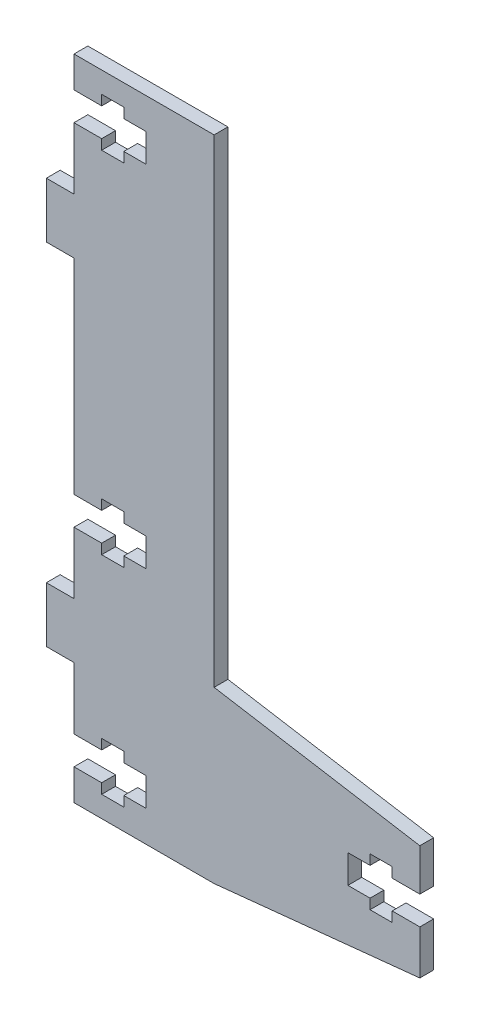
from build123d import *

# Parameters (mm, degrees)
EXTRUDE_1_DEPTH = 2


with BuildPart() as part:
    # 草图1 → 凸台-拉伸1 (new body)
    with BuildSketch(Plane.XY):
        Polygon((0, 38.932825237), (4, 38.932825237), (4, 37.482825237), (7.2, 37.482825237), (7.2, 38.932825237), (10.4, 38.932825237), (10.4, 43.032825237), (7.2, 43.032825237), (7.2, 44.482825237), (4, 44.482825237), (4, 43.032825237), (0, 43.032825237), (0, 47.532825237), (20.256410548, 47.532825237), (20.256410548, -21.642820465), (50, -26.602653907), (50, -32.667083917), (46, -32.667083917), (46, -31.217083917), (42.8, -31.217083917), (42.8, -32.667083917), (39.6, -32.667083917), (39.6, -36.767083917), (42.8, -36.767083917), (42.8, -38.217083917), (46, -38.217083917), (46, -36.767083917), (50, -36.767083917), (50, -43.167174763), (20.256410548, -46.217174763), (0, -46.217174763), (0, -41.717174763), (4, -41.717174763), (4, -43.167174763), (7.2, -43.167174763), (7.2, -41.717174763), (10.4, -41.717174763), (10.4, -37.617174763), (7.2, -37.617174763), (7.2, -36.167174763), (4, -36.167174763), (4, -37.617174763), (0, -37.617174763), (0, -28.667174763), (-4, -28.667174763), (-4, -20.667174763), (0, -20.667174763), (0, -11.717174763), (4, -11.717174763), (4, -13.167174763), (7.2, -13.167174763), (7.2, -11.717174763), (10.4, -11.717174763), (10.4, -7.617174763), (7.2, -7.617174763), (7.2, -6.167174763), (4, -6.167174763), (4, -7.617174763), (0, -7.617174763), (0, 21.982825237), (-4, 21.982825237), (-4, 29.982825237), (0, 29.982825237), align=None)
    extrude(amount=EXTRUDE_1_DEPTH)


solid = part.part
